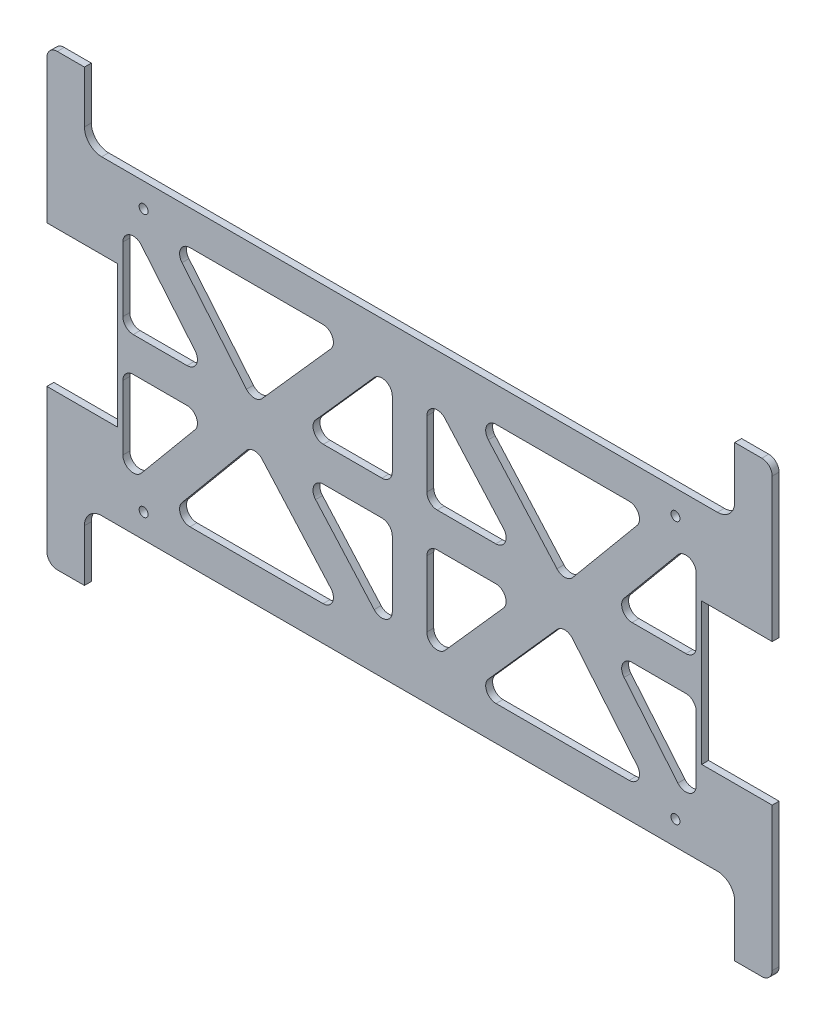
from build123d import *

# Parameters (mm, degrees)
SKETCH_1_R          = 1.75
SKETCH_1_R_2        = 1.3
EXTRUDE_1_DEPTH     = 2
SKETCH_2_W          = 20.4
SKETCH_2_H          = 41
CUT_EXTRUDE_1_DEPTH = 238.073828163
SKETCH_3_W          = 6.060289077
SKETCH_3_H          = 20
EXTRUDE_2_DEPTH     = 2
FILLET_3_R          = 5
FILLET_4_R          = 5
FILLET_5_R          = 5
FILLET_6_R          = 5


with BuildPart() as part:
    # 草图1 → 凸台-拉伸1 (new body)
    with BuildSketch(Plane.XY):
        with BuildLine():
            Line((7.8, 0), (202.2, 0))
            ThreePointArc((202.2, 0), (204.321320344, -0.878679656), (205.2, -3))
            Line((205.2, -3), (205.2, -20))
            Line((205.2, -20), (207, -20))
            ThreePointArc((207, -20), (209.121320344, -19.121320344), (210, -17))
            Line((210, -17), (210, 0))
            Line((210, 0), (210, 90))
            Line((210, 90), (210, 107))
            ThreePointArc((210, 107), (209.121320344, 109.121320344), (207, 110))
            Line((207, 110), (205.2, 110))
            Line((205.2, 110), (205.2, 93))
            ThreePointArc((205.2, 93), (204.321320344, 90.878679656), (202.2, 90))
            Line((202.2, 90), (7.8, 90))
            ThreePointArc((7.8, 90), (5.678679656, 90.878679656), (4.8, 93))
            Line((4.8, 93), (4.8, 110))
            Line((4.8, 110), (3, 110))
            ThreePointArc((3, 110), (0.878679656, 109.121320344), (0, 107))
            Line((0, 107), (0, 90))
            Line((0, 90), (0, 0))
            Line((0, 0), (0, -17))
            ThreePointArc((0, -17), (0.878679656, -19.121320344), (3, -20))
            Line((3, -20), (4.8, -20))
            Line((4.8, -20), (4.8, -3))
            ThreePointArc((4.8, -3), (5.678679656, -0.878679656), (7.8, 0))
        make_face()
        with Locations((2.5, 53)):
            Circle(SKETCH_1_R, mode=Mode.SUBTRACT)
        with Locations(Location((17.5, 53, 0), (0, 0, 180))):
            Circle(SKETCH_1_R, mode=Mode.SUBTRACT)
        with Locations((17.5, 37)):
            Circle(SKETCH_1_R, mode=Mode.SUBTRACT)
        with Locations(Location((2.5, 37, 0), (0, 0, 180))):
            Circle(SKETCH_1_R, mode=Mode.SUBTRACT)
        with Locations((207.5, 37)):
            Circle(SKETCH_1_R, mode=Mode.SUBTRACT)
        with Locations(Location((192.5, 37, 0), (0, 0, 180))):
            Circle(SKETCH_1_R, mode=Mode.SUBTRACT)
        with Locations((192.5, 53)):
            Circle(SKETCH_1_R, mode=Mode.SUBTRACT)
        with Locations(Location((207.5, 53, 0), (0, 0, 180))):
            Circle(SKETCH_1_R, mode=Mode.SUBTRACT)
        with Locations((28, 83)):
            Circle(SKETCH_1_R_2, mode=Mode.SUBTRACT)
        with Locations(Location((182, 83, 0), (0, 0, 180))):
            Circle(SKETCH_1_R_2, mode=Mode.SUBTRACT)
        with Locations((182, 7)):
            Circle(SKETCH_1_R_2, mode=Mode.SUBTRACT)
        with Locations(Location((28, 7, 0), (0, 0, 180))):
            Circle(SKETCH_1_R_2, mode=Mode.SUBTRACT)
        with BuildLine():
            Line((22, 71.710263165), (22, 53))
            ThreePointArc((22, 53), (22.878679656, 50.878679656), (25, 50))
            Line((25, 50), (40.583105292, 50))
            ThreePointArc((40.583105292, 50), (43.299697276, 51.727157515), (42.888301086, 54.919914673))
            Line((42.888301086, 54.919914673), (27.305195794, 73.630177837))
            ThreePointArc((27.305195794, 73.630177837), (23.979114939, 74.531219331), (22, 71.710263165))
        make_face(mode=Mode.SUBTRACT)
        with BuildLine():
            Line((39.111698914, 75.080085327), (57.767217115, 52.680849201))
            ThreePointArc((57.767217115, 52.680849201), (60.025200787, 51.601135394), (62.316045524, 52.60925372))
            Line((62.316045524, 52.60925372), (82.19822493, 75.008489847))
            ThreePointArc((82.19822493, 75.008489847), (82.690879074, 78.229932832), (79.954592315, 80))
            Line((79.954592315, 80), (41.416894708, 80))
            ThreePointArc((41.416894708, 80), (38.700302724, 78.272842485), (39.111698914, 75.080085327))
        make_face(mode=Mode.SUBTRACT)
        with BuildLine():
            Line((100, 72.101020514), (100, 53))
            ThreePointArc((100, 53), (99.121320344, 50.878679656), (97, 50))
            Line((97, 50), (80.045407685, 50))
            ThreePointArc((80.045407685, 50), (77.309120926, 51.770067168), (77.80177507, 54.991510153))
            Line((77.80177507, 54.991510153), (94.756367385, 74.092530668))
            ThreePointArc((94.756367385, 74.092530668), (98.065153077, 74.905561283), (100, 72.101020514))
        make_face(mode=Mode.SUBTRACT)
        with BuildLine():
            Line((113, 50), (129.954592315, 50))
            ThreePointArc((129.954592315, 50), (132.690879074, 51.770067168), (132.19822493, 54.991510153))
            Line((132.19822493, 54.991510153), (115.243632615, 74.092530668))
            ThreePointArc((115.243632615, 74.092530668), (111.934846923, 74.905561283), (110, 72.101020514))
            Line((110, 72.101020514), (110, 53))
            ThreePointArc((110, 53), (110.878679656, 50.878679656), (113, 50))
        make_face(mode=Mode.SUBTRACT)
        with BuildLine():
            Line((147.683954476, 52.60925372), (127.80177507, 75.008489847))
            ThreePointArc((127.80177507, 75.008489847), (127.309120926, 78.229932832), (130.045407685, 80))
            Line((130.045407685, 80), (168.583105292, 80))
            ThreePointArc((168.583105292, 80), (171.299697276, 78.272842485), (170.888301086, 75.080085327))
            Line((170.888301086, 75.080085327), (152.232782885, 52.680849201))
            ThreePointArc((152.232782885, 52.680849201), (149.974799213, 51.601135394), (147.683954476, 52.60925372))
        make_face(mode=Mode.SUBTRACT)
        with BuildLine():
            Line((167.111698914, 54.919914673), (182.694804206, 73.630177837))
            ThreePointArc((182.694804206, 73.630177837), (186.020885061, 74.531219331), (188, 71.710263165))
            Line((188, 71.710263165), (188, 53))
            ThreePointArc((188, 53), (187.121320344, 50.878679656), (185, 50))
            Line((185, 50), (169.416894708, 50))
            ThreePointArc((169.416894708, 50), (166.700302724, 51.727157515), (167.111698914, 54.919914673))
        make_face(mode=Mode.SUBTRACT)
        with BuildLine():
            Line((185, 40), (169.416894708, 40))
            ThreePointArc((169.416894708, 40), (166.700302724, 38.272842485), (167.111698914, 35.080085327))
            Line((167.111698914, 35.080085327), (182.694804206, 16.369822163))
            ThreePointArc((182.694804206, 16.369822163), (186.020885061, 15.468780669), (188, 18.289736835))
            Line((188, 18.289736835), (188, 37))
            ThreePointArc((188, 37), (187.121320344, 39.121320344), (185, 40))
        make_face(mode=Mode.SUBTRACT)
        with BuildLine():
            Line((170.888301086, 14.919914673), (152.232782885, 37.319150799))
            ThreePointArc((152.232782885, 37.319150799), (149.974799213, 38.398864606), (147.683954476, 37.39074628))
            Line((147.683954476, 37.39074628), (127.80177507, 14.991510153))
            ThreePointArc((127.80177507, 14.991510153), (127.309120926, 11.770067168), (130.045407685, 10))
            Line((130.045407685, 10), (168.583105292, 10))
            ThreePointArc((168.583105292, 10), (171.299697276, 11.727157515), (170.888301086, 14.919914673))
        make_face(mode=Mode.SUBTRACT)
        with BuildLine():
            Line((113, 40), (129.954592315, 40))
            ThreePointArc((129.954592315, 40), (132.690879074, 38.229932832), (132.19822493, 35.008489847))
            Line((132.19822493, 35.008489847), (115.243632615, 15.907469332))
            ThreePointArc((115.243632615, 15.907469332), (111.934846923, 15.094438717), (110, 17.898979486))
            Line((110, 17.898979486), (110, 37))
            ThreePointArc((110, 37), (110.878679656, 39.121320344), (113, 40))
        make_face(mode=Mode.SUBTRACT)
        with BuildLine():
            Line((97, 40), (80.045407685, 40))
            ThreePointArc((80.045407685, 40), (77.309120926, 38.229932832), (77.80177507, 35.008489847))
            Line((77.80177507, 35.008489847), (94.756367385, 15.907469332))
            ThreePointArc((94.756367385, 15.907469332), (98.065153077, 15.094438717), (100, 17.898979486))
            Line((100, 17.898979486), (100, 37))
            ThreePointArc((100, 37), (99.121320344, 39.121320344), (97, 40))
        make_face(mode=Mode.SUBTRACT)
        with BuildLine():
            Line((62.316045524, 37.39074628), (82.19822493, 14.991510153))
            ThreePointArc((82.19822493, 14.991510153), (82.690879074, 11.770067168), (79.954592315, 10))
            Line((79.954592315, 10), (41.416894708, 10))
            ThreePointArc((41.416894708, 10), (38.700302724, 11.727157515), (39.111698914, 14.919914673))
            Line((39.111698914, 14.919914673), (57.767217115, 37.319150799))
            ThreePointArc((57.767217115, 37.319150799), (60.025200787, 38.398864606), (62.316045524, 37.39074628))
        make_face(mode=Mode.SUBTRACT)
        with BuildLine():
            Line((42.888301086, 35.080085327), (27.305195794, 16.369822163))
            ThreePointArc((27.305195794, 16.369822163), (23.979114939, 15.468780669), (22, 18.289736835))
            Line((22, 18.289736835), (22, 37))
            ThreePointArc((22, 37), (22.878679656, 39.121320344), (25, 40))
            Line((25, 40), (40.583105292, 40))
            ThreePointArc((40.583105292, 40), (43.299697276, 38.272842485), (42.888301086, 35.080085327))
        make_face(mode=Mode.SUBTRACT)
    extrude(amount=EXTRUDE_1_DEPTH)

    # 草图2 → 切除-拉伸1 (cut, through all)
    with BuildSketch(Plane.XY.offset(2)):
        with Locations((10.2, 45)):
            Rectangle(SKETCH_2_W, SKETCH_2_H)
        with Locations((199.8, 45)):
            Rectangle(SKETCH_2_W, SKETCH_2_H)
    extrude(amount=-CUT_EXTRUDE_1_DEPTH, mode=Mode.SUBTRACT)

    # 草图3 → 凸台-拉伸2 (add)
    with BuildSketch(Plane.XY.offset(2)):
        with Locations((7.830144539, 100)):
            Rectangle(SKETCH_3_W, SKETCH_3_H)
        with Locations((202.169855462, 100)):
            Rectangle(SKETCH_3_W, SKETCH_3_H)
        with Locations((202.169855462, -10)):
            Rectangle(SKETCH_3_W, SKETCH_3_H)
        with Locations((7.830144539, -10)):
            Rectangle(SKETCH_3_W, SKETCH_3_H)
    extrude(amount=-EXTRUDE_2_DEPTH)

    # 圆角3
    fillet_3_edges = [part.edges().sort_by_distance(p)[0] for p in [
        (10.860289077, 0, 1),
    ]]
    fillet(fillet_3_edges, radius=FILLET_3_R)

    # 圆角4
    fillet_4_edges = [part.edges().sort_by_distance(p)[0] for p in [
        (199.139710923, 0, 1),
    ]]
    fillet(fillet_4_edges, radius=FILLET_4_R)

    # 圆角5
    fillet_5_edges = [part.edges().sort_by_distance(p)[0] for p in [
        (199.139710923, 90, 1),
    ]]
    fillet(fillet_5_edges, radius=FILLET_5_R)

    # 圆角6
    fillet_6_edges = [part.edges().sort_by_distance(p)[0] for p in [
        (10.860289077, 90, 1),
    ]]
    fillet(fillet_6_edges, radius=FILLET_6_R)


solid = part.part
